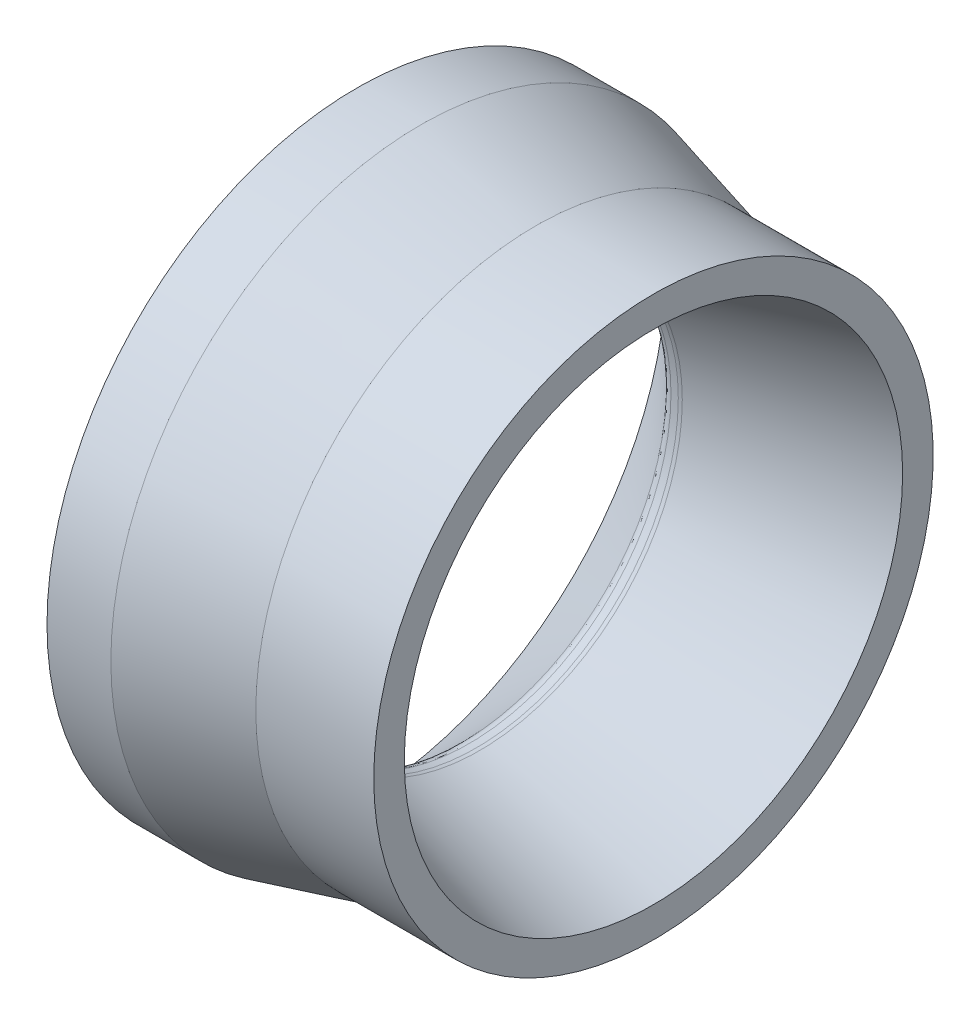
from build123d import *


with BuildPart() as part:
    # Sketch1 → Revolve1 (revolve)
    with BuildSketch(Plane.XY, mode=Mode.PRIVATE) as revolve1_sk:
        with BuildLine():
            Line((12.058408399, 22.739591601), (19.723685425, 15.074314575))
            ThreePointArc((19.723685425, 15.074314575), (19.983224104, 14.900896374), (20.28937085, 14.84))
            Line((20.28937085, 14.84), (20.826347502, 14.84))
            ThreePointArc((20.826347502, 14.84), (20.956873695, 14.848555139), (21.085166548, 14.874074174))
            Line((21.085166548, 14.874074174), (33.843289446, 18.292602901))
            Line((33.843289446, 18.292602901), (33.843289446, 20.53500071))
            Line((33.843289446, 20.53500071), (25.18437156, 20.53500071))
            Line((25.18437156, 20.53500071), (16.74635158, 22.739591601))
            Line((16.74635158, 22.739591601), (12.058408399, 22.739591601))
        make_face()
    revolve(revolve1_sk.sketch.rotate(Axis((0, 0, 0), (1, 0, 0)), 90), axis=Axis((0, 0, 0), (1, 0, 0)))


solid = part.part
